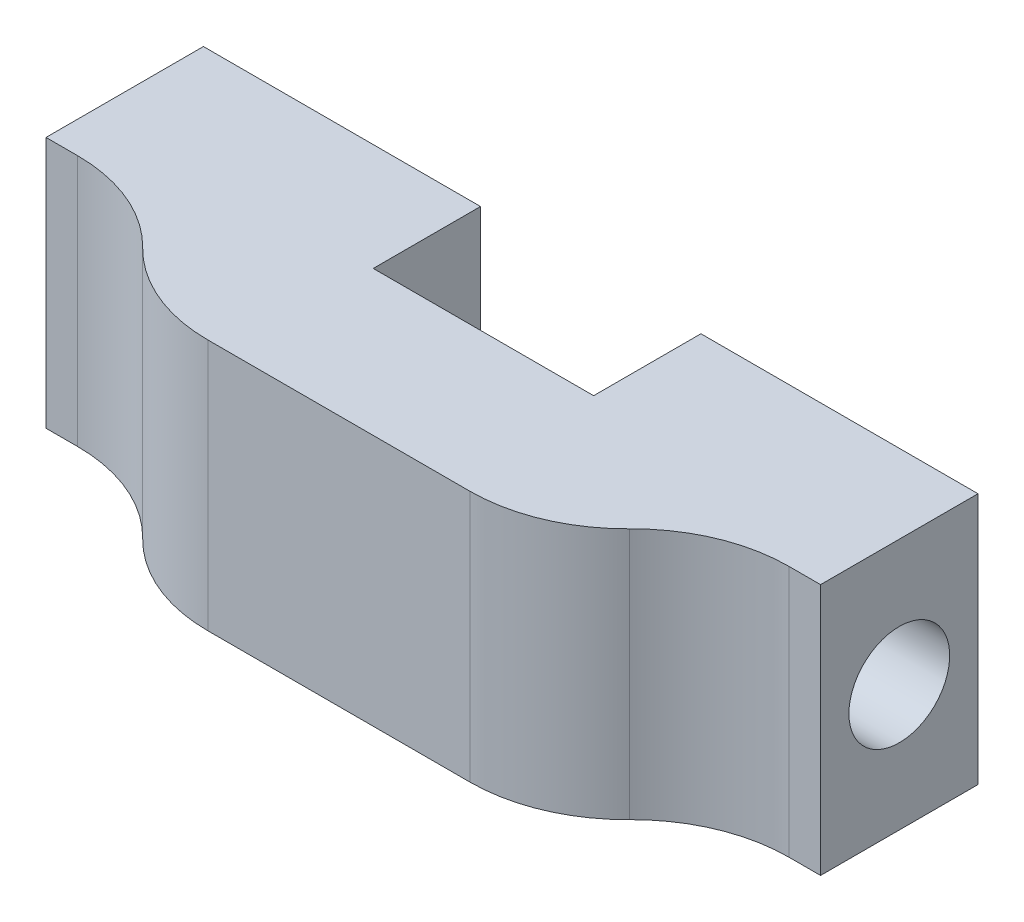
from build123d import *

# Parameters (mm, degrees)
BOSS_EXTRUDE1_START      = -4
BOSS_EXTRUDE1_DEPTH      = 8
M3_CLEARANCE_HOLE1_D     = 3.2
M3_CLEARANCE_HOLE1_DEPTH = 8.8


with BuildPart() as part:
    # Sketch2 → Boss-Extrude1 (new body)
    with BuildSketch(Plane(origin=(0, 0, 0), x_dir=(1, 0, 0), z_dir=(0, 1, 0)).offset(BOSS_EXTRUDE1_START)):
        with BuildLine():
            ThreePointArc((-7.729285786, -6.5), (-6.095063245, -7.609772229), (-4.158571571, -8))
            Line((-4.158571571, -8), (4.158571571, -8))
            ThreePointArc((4.158571571, -8), (6.095063245, -7.609772229), (7.729285786, -6.5))
            ThreePointArc((7.729285786, -6.5), (9.363508327, -5.390227771), (11.3, -5))
            Line((11.3, -5), (12.3, -5))
            Line((12.3, -5), (12.3, 0))
            Line((12.3, 0), (11.3, 0))
            Line((11.3, 0), (3.5, 0))
            Line((3.5, 0), (3.5, -3.407197308))
            Line((3.5, -3.407197308), (-3.5, -3.407197308))
            Line((-3.5, -3.407197308), (-3.5, 0))
            Line((-3.5, 0), (-11.3, 0))
            Line((-11.3, 0), (-12.3, 0))
            Line((-12.3, 0), (-12.3, -5))
            Line((-12.3, -5), (-11.3, -5))
            ThreePointArc((-11.3, -5), (-9.363508327, -5.390227771), (-7.729285786, -6.5))
        make_face()
    extrude(amount=BOSS_EXTRUDE1_DEPTH)

    # M3 Clearance Hole1
    with Locations(Plane.ZY.offset(12.3)):
        with Locations((2.5, 0)):
            m3_clearance_hole1 = Hole(M3_CLEARANCE_HOLE1_D / 2, depth=M3_CLEARANCE_HOLE1_DEPTH)

    # Mirror1: M3 Clearance Hole1 across plane
    add(m3_clearance_hole1.mirror(Plane(origin=(0, 0, 0), x_dir=(0, 0, 1), z_dir=(1, 0, 0))), mode=Mode.SUBTRACT)


solid = part.part
